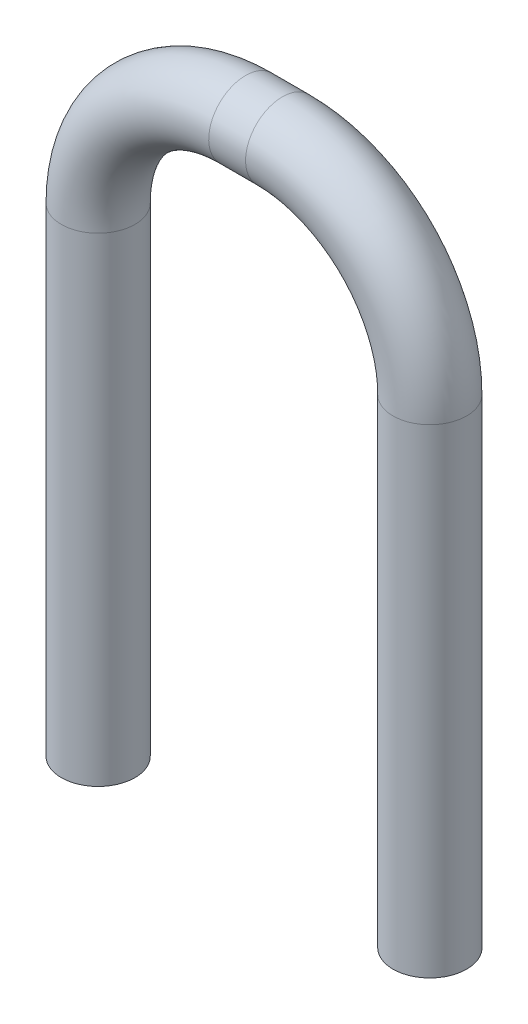
from build123d import *

# Parameters (mm, degrees)
BALAYAGE1_PROFILE_R = 1


with BuildPart() as part:
    # Balayage1: sweep along a path in Esquisse1
    with BuildLine(Plane.XY) as balayage1_path:
        Line((-4.5, 0), (-4.5, 13))
        ThreePointArc((-4.5, 13), (-3.328427125, 15.828427125), (-0.5, 17))
        Line((-0.5, 17), (0.5, 17))
        ThreePointArc((0.5, 17), (3.328427125, 15.828427125), (4.5, 13))
        Line((4.5, 13), (4.5, 0))
    # Balayage1 profile (on start of the path) → Balayage1 (sweep)
    with BuildSketch(Plane(origin=(-4.5, 0, 0), x_dir=(1, 0, 0), z_dir=(0, 1, 0))):
        Circle(BALAYAGE1_PROFILE_R)
    sweep(path=balayage1_path.line)


solid = part.part
